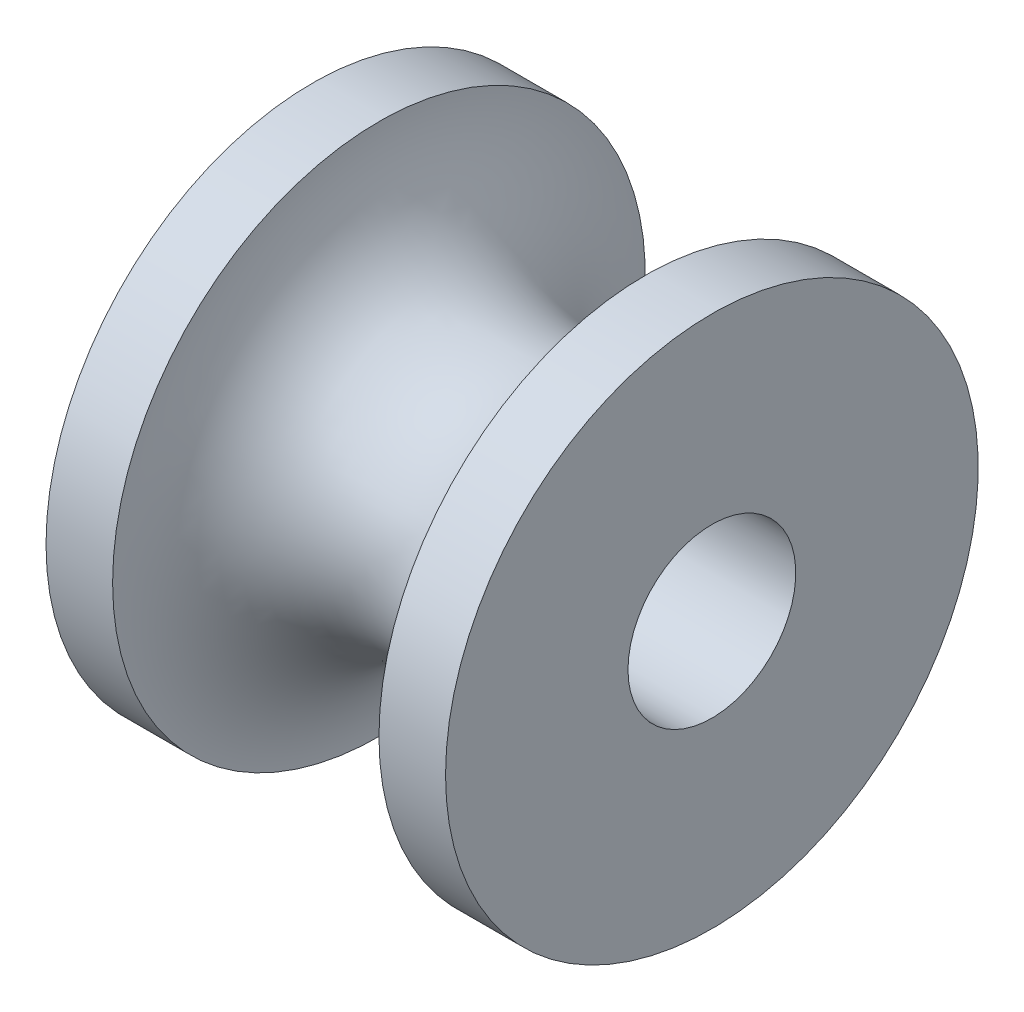
from build123d import *

# Parameters (mm, degrees)
SKETCH1_R           = 3.175
SKETCH1_R_2         = 1
BOSS_EXTRUDE1_DEPTH = 2.38125
SKETCH2_R           = 1.5875


with BuildPart() as part:
    # Sketch1 → Boss-Extrude1 (new, symmetric)
    with BuildSketch(Plane(origin=(0, 0, 0), x_dir=(0, 0, -1), z_dir=(1, 0, 0))):
        with Locations(Location((0, 0, 0), (0, 0, 180))):
            Circle(SKETCH1_R)
        with Locations(Location((0, 0, 0), (0, 0, 180))):
            Circle(SKETCH1_R_2, mode=Mode.SUBTRACT)
    extrude(amount=BOSS_EXTRUDE1_DEPTH, both=True)

    # Sketch2 → Cut-Revolve1 (revolve, cut)
    with BuildSketch(Plane(origin=(0, 0, 0), x_dir=(1, 0, 0), z_dir=(0, 1, 0))):
        with Locations((0, -3.175)):
            Circle(SKETCH2_R)
    revolve(axis=Axis((2.38125, 0, 0), (-1, 0, 0)), mode=Mode.SUBTRACT)


solid = part.part
